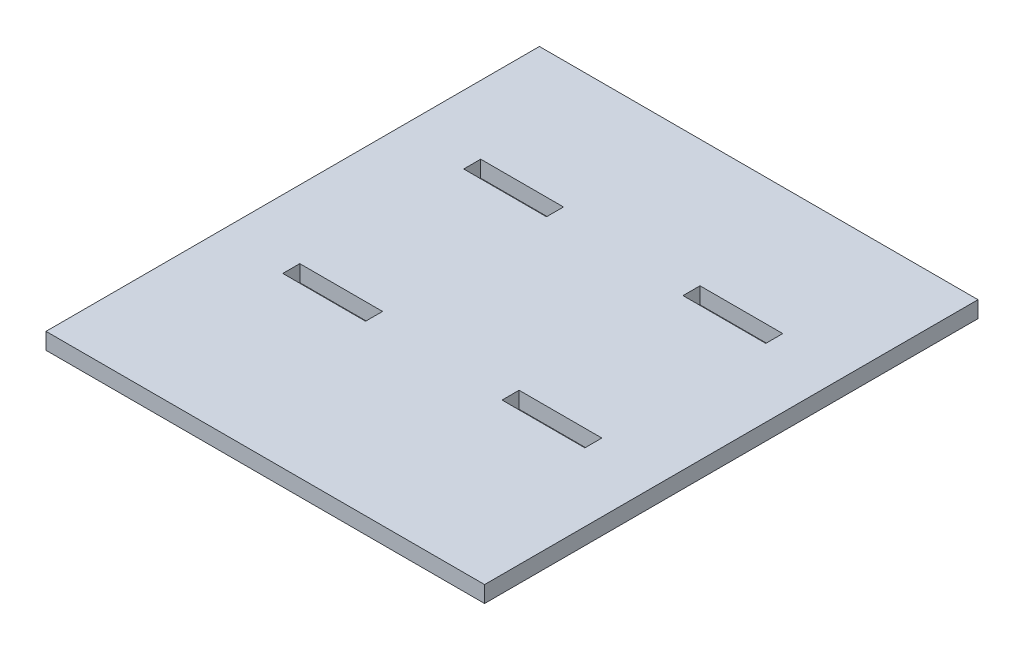
from build123d import *

# Parameters (mm, degrees)
SKETCH2_W           = 80
SKETCH2_H           = 90
SKETCH2_W_2         = 15.1
SKETCH2_H_2         = 3.1
BOSS_EXTRUDE4_DEPTH = 3


with BuildPart() as part:
    # Sketch2 → Boss-Extrude4 (new body)
    with BuildSketch(Plane(origin=(0, 0, 0), x_dir=(1, 0, 0), z_dir=(0, 1, 0))):
        with Locations((40, 45)):
            Rectangle(SKETCH2_W, SKETCH2_H)
        with Locations((20, 32.29)):
            Rectangle(SKETCH2_W_2, SKETCH2_H_2, mode=Mode.SUBTRACT)
        with Locations((20, 65.29)):
            Rectangle(SKETCH2_W_2, SKETCH2_H_2, mode=Mode.SUBTRACT)
        with Locations((60, 32.29)):
            Rectangle(SKETCH2_W_2, SKETCH2_H_2, mode=Mode.SUBTRACT)
        with Locations((60, 65.29)):
            Rectangle(SKETCH2_W_2, SKETCH2_H_2, mode=Mode.SUBTRACT)
    extrude(amount=BOSS_EXTRUDE4_DEPTH)


solid = part.part
